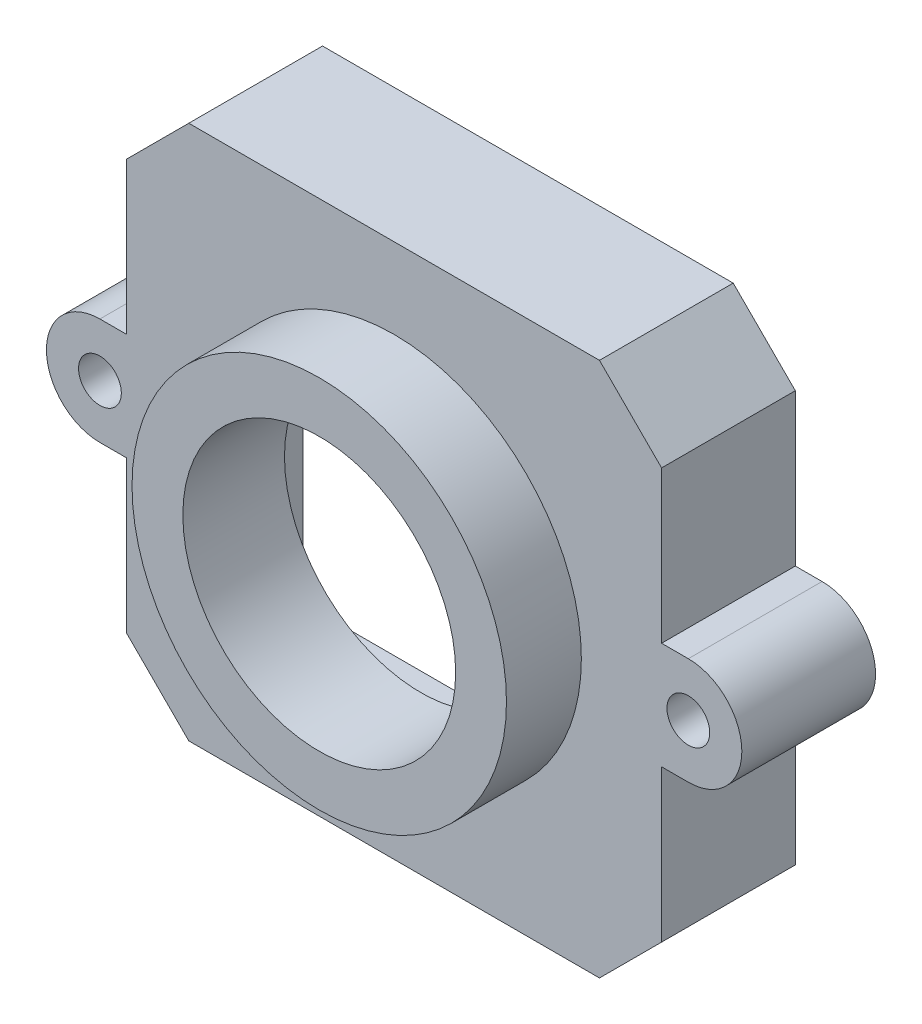
from build123d import *

# Parameters (mm, degrees)
SKETCH1_R                = 0.8
ROOF_DEPTH               = 1
WALLS_START              = -4
SKETCH1_3_R              = 0.8
WALLS_DEPTH              = 4
SKETCH2_R                = 5.1
SCREW_HOLE_IN_ROOF_DEPTH = 18.146428369
SCREW_START              = 2.8
SKETCH2_3_R              = 7
SKETCH2_3_R_2            = 5.1
SCREW_HOLDER_DEPTH       = 2.8


with BuildPart() as part:
    # Sketch1 → Roof (new body)
    with BuildSketch(Plane.XY):
        with BuildLine():
            Line((-7.67766953, 10), (-10, 7.67766953))
            Line((-10, 7.67766953), (-10, 2))
            Line((-10, 2), (-11.000000224, 2))
            ThreePointArc((-11.000000224, 2), (-13.000000224, 0), (-11.000000224, -2))
            Line((-11.000000224, -2), (-10, -2))
            Line((-10, -2), (-10, -7.67766953))
            Line((-10, -7.67766953), (-7.67766953, -10))
            Line((-7.67766953, -10), (7.67766953, -10))
            Line((7.67766953, -10), (10, -7.67766953))
            Line((10, -7.67766953), (10, -2))
            Line((10, -2), (11, -2))
            ThreePointArc((11, -2), (13, 0), (11, 2))
            Line((11, 2), (10, 2))
            Line((10, 2), (10, 7.67766953))
            Line((10, 7.67766953), (7.67766953, 10))
            Line((7.67766953, 10), (-7.67766953, 10))
        make_face()
        with Locations((11, 0)):
            Circle(SKETCH1_R, mode=Mode.SUBTRACT)
        with Locations((-11.000000224, 0)):
            Circle(SKETCH1_R, mode=Mode.SUBTRACT)
    extrude(amount=ROOF_DEPTH)

    # Sketch1<3> → Walls (add)
    with BuildSketch(Plane.XY.offset(WALLS_START)):
        with BuildLine():
            Line((-7.67766953, 10), (-10, 7.67766953))
            Line((-10, 7.67766953), (-10, 2))
            Line((-10, 2), (-11.000000224, 2))
            ThreePointArc((-11.000000224, 2), (-13.000000224, 0), (-11.000000224, -2))
            Line((-11.000000224, -2), (-10, -2))
            Line((-10, -2), (-10, -7.67766953))
            Line((-10, -7.67766953), (-7.67766953, -10))
            Line((-7.67766953, -10), (7.67766953, -10))
            Line((7.67766953, -10), (10, -7.67766953))
            Line((10, -7.67766953), (10, -2))
            Line((10, -2), (11, -2))
            ThreePointArc((11, -2), (13, 0), (11, 2))
            Line((11, 2), (10, 2))
            Line((10, 2), (10, 7.67766953))
            Line((10, 7.67766953), (7.67766953, 10))
            Line((7.67766953, 10), (-7.67766953, 10))
        make_face()
        Polygon((-8.4, -7.01492783), (-8.4, 7.01492783), (-7.01492783, 8.4), (7.01492783, 8.4), (8.4, 7.01492783), (8.4, -7.01492783), (7.01492783, -8.4), (-7.01492783, -8.4), align=None, mode=Mode.SUBTRACT)
        with Locations((11, 0)):
            Circle(SKETCH1_3_R, mode=Mode.SUBTRACT)
        with Locations((-11.000000224, 0)):
            Circle(SKETCH1_3_R, mode=Mode.SUBTRACT)
    extrude(amount=WALLS_DEPTH)

    # Sketch2 → Screw hole in roof (cut, through all)
    with BuildSketch(Plane.XY.offset(1)):
        Circle(SKETCH2_R)
    extrude(amount=-SCREW_HOLE_IN_ROOF_DEPTH, mode=Mode.SUBTRACT)

    # Sketch2<3> → Screw holder (add)
    with BuildSketch(Plane.XY.offset(1).offset(SCREW_START)):
        Circle(SKETCH2_3_R)
        Circle(SKETCH2_3_R_2, mode=Mode.SUBTRACT)
    extrude(amount=-SCREW_HOLDER_DEPTH)


solid = part.part
